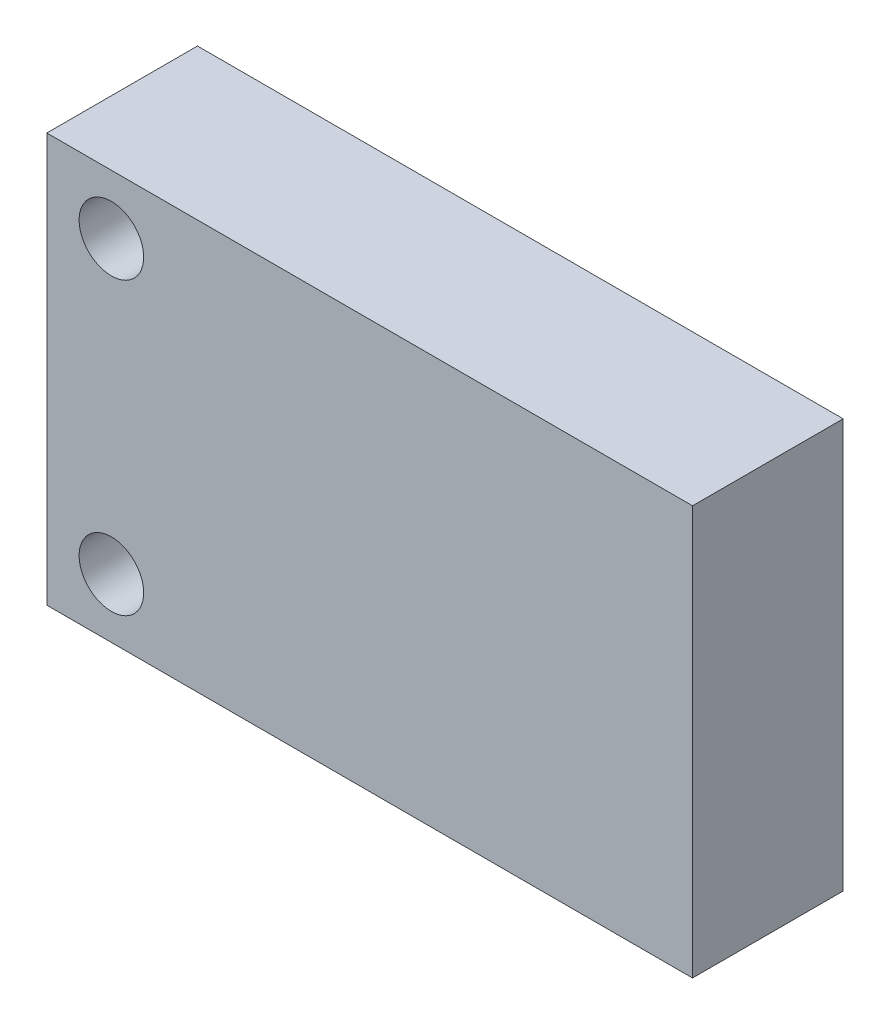
from build123d import *

# Parameters (mm, degrees)
SKIZZE1_W                       = 30
SKIZZE1_H                       = 19
AUFSATZ_LINEAR_AUSTRAGEN1_DEPTH = 7
SKIZZE2_R                       = 1.5
SCHNITT_LINEAR_AUSTRAGEN1_DEPTH = 20.085334684


with BuildPart() as part:
    # Skizze1 → Aufsatz-Linear austragen1 (new body)
    with BuildSketch(Plane.XY):
        Rectangle(SKIZZE1_W, SKIZZE1_H)
    extrude(amount=AUFSATZ_LINEAR_AUSTRAGEN1_DEPTH)

    # Skizze2 → Schnitt-Linear austragen1 (cut, through all)
    with BuildSketch(Plane.XY.offset(7)):
        with Locations((-12, 6.75)):
            Circle(SKIZZE2_R)
        with Locations((-12, -6.75)):
            Circle(SKIZZE2_R)
    extrude(amount=-SCHNITT_LINEAR_AUSTRAGEN1_DEPTH, mode=Mode.SUBTRACT)


solid = part.part
